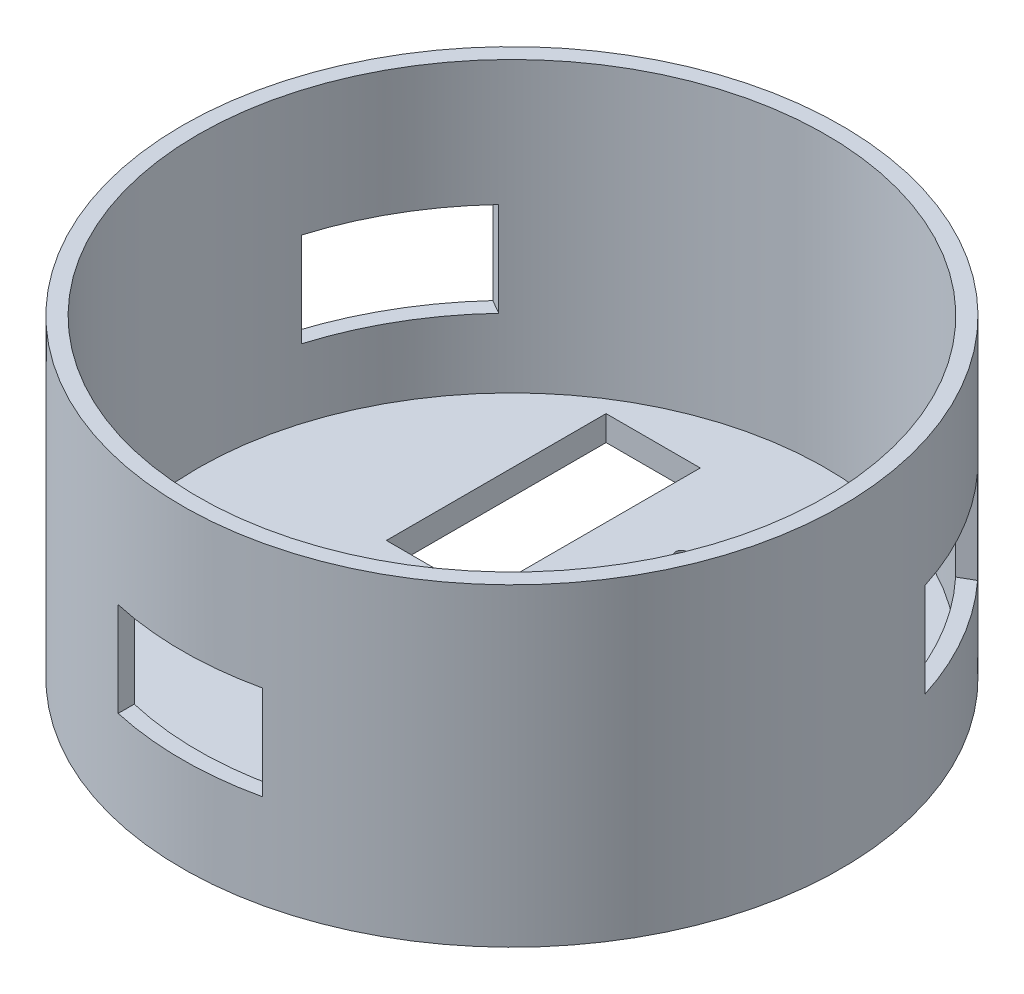
from build123d import *

# Parameters (mm, degrees)
SKETCH_2_W               = 46
SKETCH_2_H               = 30
CUT_EXTRUDE_1_DEPTH      = 180.0251379
PATTERN_CIRCULAR_1_COUNT = 3
SKETCH_3_W               = 30
SKETCH_3_H               = 70
CUT_EXTRUDE_2_DEPTH      = 180.0251379


with BuildPart() as part:
    # 草图1 → 旋转1 (revolve)
    with BuildSketch(Plane.XY):
        Polygon((-105, 100), (-100, 100), (-100, 8), (0, 8), (0, 0), (-105, 0), align=None)
    revolve(axis=Axis((0, 100, 0), (0, -1, 0)))

    # 草图2 → 切除-拉伸1 (cut, through all)
    with BuildSketch(Plane.XY):
        with Locations((0, 45)):
            Rectangle(SKETCH_2_W, SKETCH_2_H)
    cut_extrude_1 = extrude(amount=CUT_EXTRUDE_1_DEPTH, mode=Mode.SUBTRACT)

    # 阵列(圆周)1: 切除-拉伸1 ×3 about axis
    pattern_circular_1_axis = Axis((0, 0, 0), (0, 1, 0))
    for i in range(1, PATTERN_CIRCULAR_1_COUNT):
        add(cut_extrude_1.rotate(pattern_circular_1_axis, i * 360 / PATTERN_CIRCULAR_1_COUNT), mode=Mode.SUBTRACT)

    # 草图3 → 切除-拉伸2 (cut, through all)
    with BuildSketch(Plane(origin=(0, 0, 0), x_dir=(1, 0, 0), z_dir=(0, 1, 0))):
        with Locations((35, -45)):
            Rectangle(SKETCH_3_W, SKETCH_3_H)
        with BuildLine():
            Line((-17, -54.8), (-1, -54.8))
            ThreePointArc((-1, -54.8), (0.8, -53), (-1, -51.2))
            Line((-1, -51.2), (-17, -51.2))
            ThreePointArc((-17, -51.2), (-18.8, -53), (-17, -54.8))
        make_face()
        with BuildLine():
            Line((-17, -38.8), (-1, -38.8))
            ThreePointArc((-1, -38.8), (0.8, -37), (-1, -35.2))
            Line((-1, -35.2), (-17, -35.2))
            ThreePointArc((-17, -35.2), (-18.8, -37), (-17, -38.8))
        make_face()
        with BuildLine():
            Line((17, 38.8), (1, 38.8))
            ThreePointArc((1, 38.8), (-0.8, 37), (1, 35.2))
            Line((1, 35.2), (17, 35.2))
            ThreePointArc((17, 35.2), (18.8, 37), (17, 38.8))
        make_face()
        with BuildLine():
            Line((17, 54.8), (1, 54.8))
            ThreePointArc((1, 54.8), (-0.8, 53), (1, 51.2))
            Line((1, 51.2), (17, 51.2))
            ThreePointArc((17, 51.2), (18.8, 53), (17, 54.8))
        make_face()
        with Locations((-35, 45)):
            Rectangle(SKETCH_3_W, SKETCH_3_H)
    extrude(amount=CUT_EXTRUDE_2_DEPTH, mode=Mode.SUBTRACT)


solid = part.part
